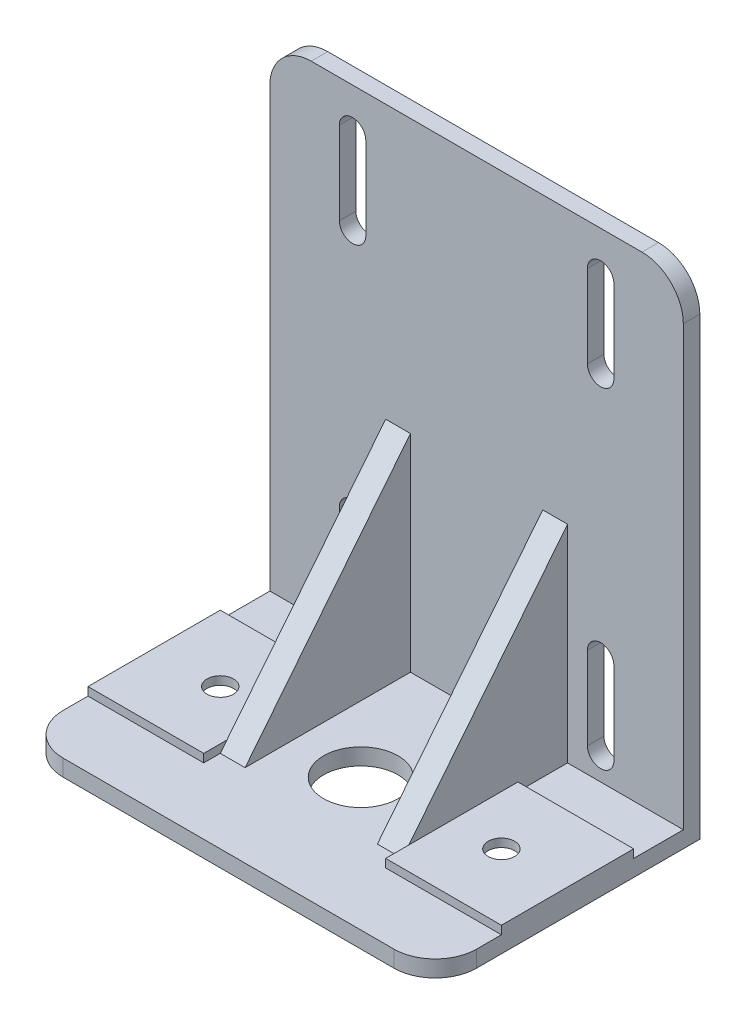
from build123d import *

# Parameters (mm, degrees)
DODANIE_WYCI_GNI_CIE1_DEPTH = 2
WYTNIJ_WYCI_GNI_CIE1_REACH  = 41.102
SZKIC4_W                    = 50
SZKIC4_H                    = 2
DODANIE_WYCI_GNI_CIE2_DEPTH = 30
DODANIE_WYCI_GNI_CIE3_START = -14
DODANIE_WYCI_GNI_CIE3_DEPTH = 3
ZAOKR_GLENIE1_R             = 5
SZKIC7_R                    = 4.5
WYTNIJ_WYCI_GNI_CIE2_DEPTH  = 2
SZKIC8_W                    = 14
SZKIC8_H                    = 16
SZKIC8_R                    = 1.6
DODANIE_WYCI_GNI_CIE4_DEPTH = 1


with BuildPart() as part:
    # Szkic1 → Dodanie-wyciągnięcie1 (new body)
    with BuildSketch(Plane.XY):
        with BuildLine():
            Line((-25, -30), (25, -30))
            Line((25, -30), (25, 25))
            ThreePointArc((25, 25), (23.535533906, 28.535533906), (20, 30))
            Line((20, 30), (-20, 30))
            ThreePointArc((-20, 30), (-23.535533906, 28.535533906), (-25, 25))
            Line((-25, 25), (-25, -30))
        make_face()
    extrude(amount=DODANIE_WYCI_GNI_CIE1_DEPTH)

    # Szkic2 → Wytnij-wyciągnięcie1 (cut, up to next)
    with BuildSketch(Plane.XY.offset(2), mode=Mode.PRIVATE) as wytnij_wyci_gni_cie1_sk1:
        with BuildLine():
            Line((-13.4, 25), (-13.4, 15))
            ThreePointArc((-13.4, 15), (-15, 13.4), (-16.6, 15))
            Line((-16.6, 15), (-16.6, 25))
            ThreePointArc((-16.6, 25), (-15, 26.6), (-13.4, 25))
        make_face()
    wytnij_wyci_gni_cie1_tool1 = extrude(wytnij_wyci_gni_cie1_sk1.sketch, amount=-WYTNIJ_WYCI_GNI_CIE1_REACH, mode=Mode.PRIVATE) & part.part
    # Szkic2 → Wytnij-wyciągnięcie1 (cut, up to next)
    with BuildSketch(Plane.XY.offset(2), mode=Mode.PRIVATE) as wytnij_wyci_gni_cie1_sk2:
        with BuildLine():
            Line((13.4, 25), (13.4, 15))
            ThreePointArc((13.4, 15), (15, 13.4), (16.6, 15))
            Line((16.6, 15), (16.6, 25))
            ThreePointArc((16.6, 25), (15, 26.6), (13.4, 25))
        make_face()
    wytnij_wyci_gni_cie1_tool2 = extrude(wytnij_wyci_gni_cie1_sk2.sketch, amount=-WYTNIJ_WYCI_GNI_CIE1_REACH, mode=Mode.PRIVATE) & part.part
    # Szkic2 → Wytnij-wyciągnięcie1 (cut, up to next)
    with BuildSketch(Plane.XY.offset(2), mode=Mode.PRIVATE) as wytnij_wyci_gni_cie1_sk3:
        with BuildLine():
            Line((13.4, -25), (13.4, -15))
            ThreePointArc((13.4, -15), (15, -13.4), (16.6, -15))
            Line((16.6, -15), (16.6, -25))
            ThreePointArc((16.6, -25), (15, -26.6), (13.4, -25))
        make_face()
    wytnij_wyci_gni_cie1_tool3 = extrude(wytnij_wyci_gni_cie1_sk3.sketch, amount=-WYTNIJ_WYCI_GNI_CIE1_REACH, mode=Mode.PRIVATE) & part.part
    # Szkic2 → Wytnij-wyciągnięcie1 (cut, up to next)
    with BuildSketch(Plane.XY.offset(2), mode=Mode.PRIVATE) as wytnij_wyci_gni_cie1_sk4:
        with BuildLine():
            Line((-13.4, -25), (-13.4, -15))
            ThreePointArc((-13.4, -15), (-15, -13.4), (-16.6, -15))
            Line((-16.6, -15), (-16.6, -25))
            ThreePointArc((-16.6, -25), (-15, -26.6), (-13.4, -25))
        make_face()
    wytnij_wyci_gni_cie1_tool4 = extrude(wytnij_wyci_gni_cie1_sk4.sketch, amount=-WYTNIJ_WYCI_GNI_CIE1_REACH, mode=Mode.PRIVATE) & part.part
    add(wytnij_wyci_gni_cie1_tool1.solids().sort_by_distance((-15, 20, 2))[0], mode=Mode.SUBTRACT)
    add(wytnij_wyci_gni_cie1_tool2.solids().sort_by_distance((15, 20, 2))[0], mode=Mode.SUBTRACT)
    add(wytnij_wyci_gni_cie1_tool3.solids().sort_by_distance((15, -20, 2))[0], mode=Mode.SUBTRACT)
    add(wytnij_wyci_gni_cie1_tool4.solids().sort_by_distance((-15, -20, 2))[0], mode=Mode.SUBTRACT)

    # Szkic4 → Dodanie-wyciągnięcie2 (add)
    with BuildSketch(Plane.XY.offset(2)):
        with Locations((0, -29)):
            Rectangle(SZKIC4_W, SZKIC4_H)
    extrude(amount=DODANIE_WYCI_GNI_CIE2_DEPTH)


with BuildPart() as body_2:
    # Szkic6 → Dodanie-wyciągnięcie3 (new body)
    with BuildSketch(Plane.ZY.offset(25).offset(DODANIE_WYCI_GNI_CIE3_START)):
        Polygon((2, -28), (2, -3), (22, -28), align=None)
    dodanie_wyci_gni_cie3 = extrude(amount=-DODANIE_WYCI_GNI_CIE3_DEPTH)


with BuildPart() as part_1:
    add(part.part)

    # Lustro3: Dodanie-wyciągnięcie3 across plane
    add(dodanie_wyci_gni_cie3.mirror(Plane(origin=(0, 0, 0), x_dir=(0, 0, 1), z_dir=(1, 0, 0))))

    # Zaokrąglenie1
    zaokr_glenie1_edges = [part_1.edges().sort_by_distance(p)[0] for p in [
        (-25, -29, 32),
        (25, -29, 32),
    ]]
    fillet(zaokr_glenie1_edges, radius=ZAOKR_GLENIE1_R)

    # Szkic7 → Wytnij-wyciągnięcie2 (cut)
    with BuildSketch(Plane.XZ.offset(30)):
        with Locations(Location((0, 16, 0), (0, 0, 270))):
            Circle(SZKIC7_R)
        with Locations(Location((-17, 16, 0), (0, 0, 270))):
            Circle(SZKIC7_R)
        with Locations(Location((17, 16, 0), (0, 0, 270))):
            Circle(SZKIC7_R)
    extrude(amount=-WYTNIJ_WYCI_GNI_CIE2_DEPTH, mode=Mode.SUBTRACT)

    add(body_2.part)  # Dodanie-wyciągnięcie4 merges body 2
    # Szkic8 → Dodanie-wyciągnięcie4 (add)
    # profile 1 of 2: a face of its own
    with BuildSketch(Plane(origin=(0, -28, 0), x_dir=(1, 0, 0), z_dir=(0, 1, 0))):
        with Locations((-18, -16)):
            Rectangle(SZKIC8_W, SZKIC8_H)
        with Locations(Location((-17, -16, 0), (0, 0, 270))):
            Circle(SZKIC8_R, mode=Mode.SUBTRACT)
    # profile 2 of 2: a face of its own
    with BuildSketch(Plane(origin=(0, -28, 0), x_dir=(1, 0, 0), z_dir=(0, 1, 0))):
        with Locations((18, -16)):
            Rectangle(SZKIC8_W, SZKIC8_H)
        with Locations(Location((17, -16, 0), (0, 0, 90))):
            Circle(SZKIC8_R, mode=Mode.SUBTRACT)
    extrude(amount=DODANIE_WYCI_GNI_CIE4_DEPTH)


solid = part_1.part
